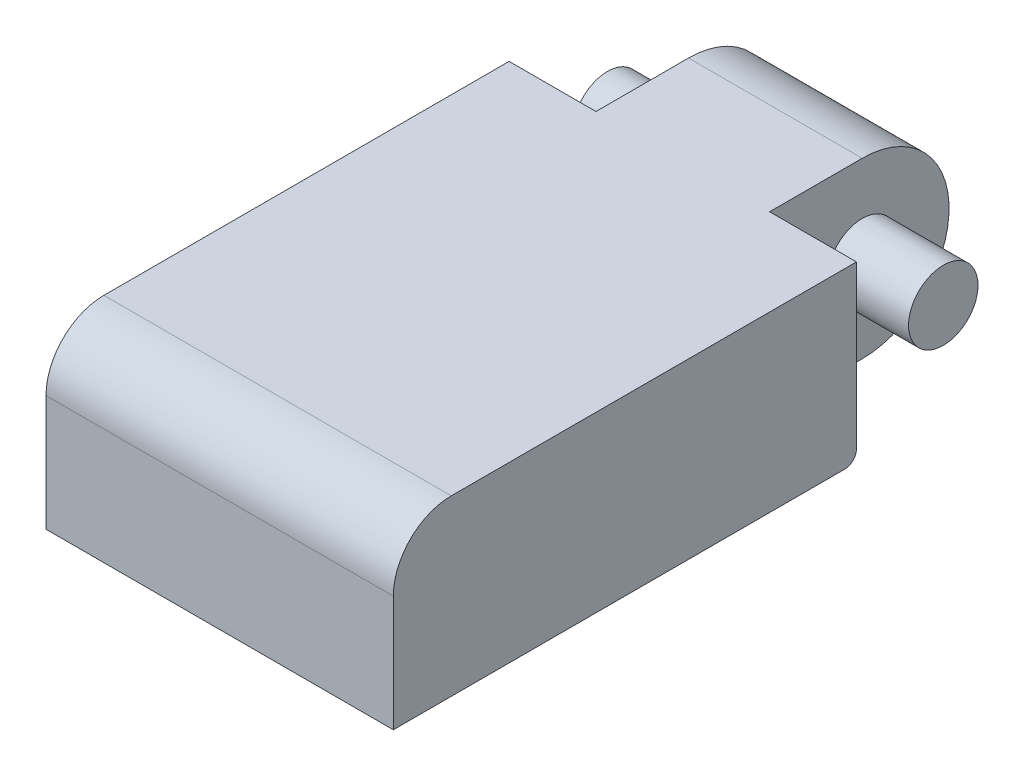
from build123d import *

# Parameters (mm, degrees)
SKETCH_1_W      = 30
SKETCH_1_H      = 15
EXTRUDE_1_DEPTH = 40
EXTRUDE_3_DEPTH = 7.5
SKETCH_7_R      = 3
EXTRUDE_4_DEPTH = 7
FILLET_1_R      = 5
FILLET_2_R      = 1


with BuildPart() as part:
    # 草图1 → 凸台-拉伸1 (new body)
    with BuildSketch(Plane.XY):
        Rectangle(SKETCH_1_W, SKETCH_1_H)
    extrude(amount=EXTRUDE_1_DEPTH)

    # 草图6 → 凸台-拉伸3 (add, symmetric)
    with BuildSketch(Plane(origin=(0, 0, 0), x_dir=(0, 0, -1), z_dir=(1, 0, 0))):
        with BuildLine():
            Line((0, 7.5), (8, 7.5))
            ThreePointArc((8, 7.5), (15.5, 0), (8, -7.5))
            Line((8, -7.5), (0, -7.5))
            Line((0, -7.5), (0, 7.5))
        make_face()
    extrude(amount=EXTRUDE_3_DEPTH, both=True)

    # 草图7 → 凸台-拉伸4 (add)
    with BuildSketch(Plane(origin=(7.5, 0, 0), x_dir=(0, 0, -1), z_dir=(1, 0, 0))):
        with Locations(Location((8, 0, 0), (0, 0, 180))):
            Circle(SKETCH_7_R)
    extrude_4 = extrude(amount=EXTRUDE_4_DEPTH)

    # 镜向2: 凸台-拉伸4 across plane
    add(extrude_4.mirror(Plane(origin=(0, 0, 0), x_dir=(0, 0, 1), z_dir=(1, 0, 0))))

    # 圆角1
    fillet_1_edges = [part.edges().sort_by_distance(p)[0] for p in [
        (0, 7.5, 40),
    ]]
    fillet(fillet_1_edges, radius=FILLET_1_R)

    # 圆角2
    fillet_2_edges = [part.edges().sort_by_distance(p)[0] for p in [
        (11.25, -7.5, 0),
        (-11.25, -7.5, 0),
    ]]
    fillet(fillet_2_edges, radius=FILLET_2_R)


solid = part.part
